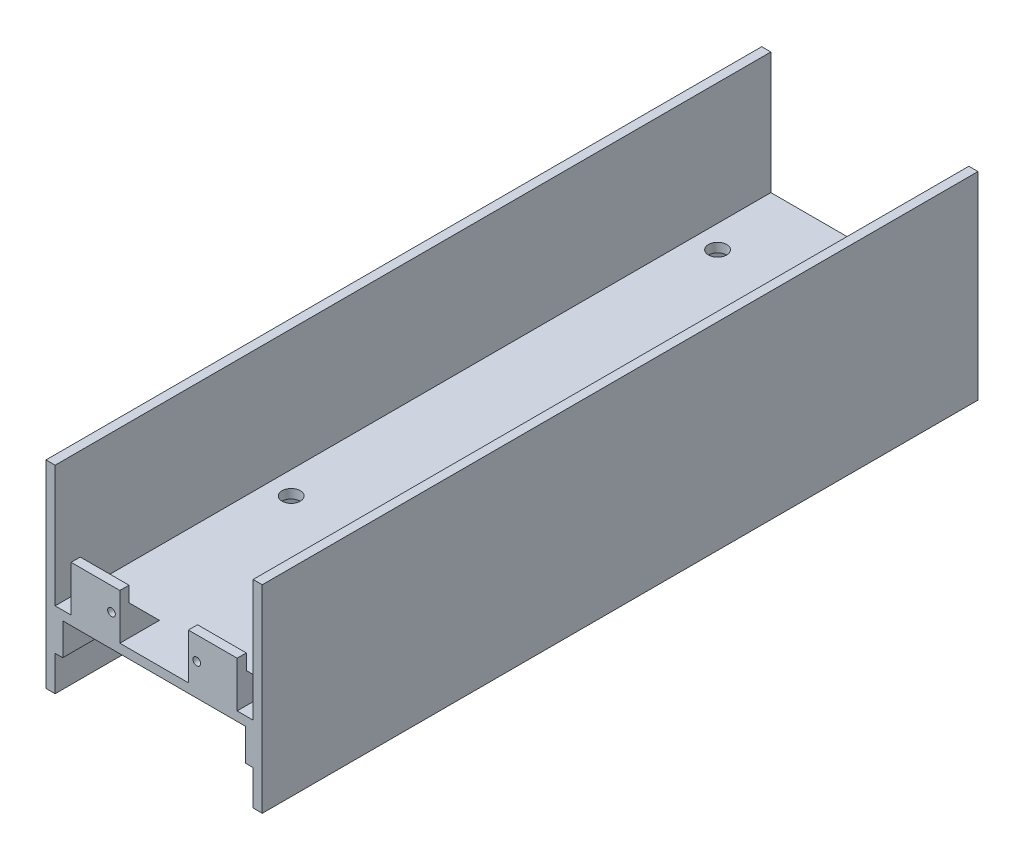
from build123d import *

# Parameters (mm, degrees)
BOSS_EXTRUDE1_DEPTH      = 82
BOSS_EXTRUDE1_DEPTH_BACK = 153
SKETCH3_W                = 16
SKETCH3_H                = 3
BOSS_EXTRUDE3_DEPTH      = 15
CHAMFER1_SIZE            = 10
SKETCH4_R                = 1.25
CUT_EXTRUDE1_DEPTH       = 10
SKETCH2_R                = 3
CUT_EXTRUDE2_DEPTH       = 10


with BuildPart() as part:
    # Sketch1 → Boss-Extrude1 (new, two sides: drawn at the far end of the back side and taken through both)
    with BuildSketch(Plane.XY.offset(-BOSS_EXTRUDE1_DEPTH_BACK)):
        Polygon((-32.5, 13), (-32.5, 1.5), (-35.5, 1.5), (-35.5, 26.5), (-35.5, 66.5), (-32.5, 66.5), (-32.5, 26.5), (32.5, 26.5), (32.5, 66.5), (35.5, 66.5), (35.5, 26.5), (35.5, 1.5), (32.5, 1.5), (32.5, 13), (30, 13), (30, 23.5), (-30, 23.5), (-30, 13), align=None)
    extrude(amount=BOSS_EXTRUDE1_DEPTH + BOSS_EXTRUDE1_DEPTH_BACK)

    # Sketch3 → Boss-Extrude3 (add)
    with BuildSketch(Plane(origin=(0, 26.5, 0), x_dir=(1, 0, 0), z_dir=(0, 1, 0))):
        with Locations((-19.25, -80.5)):
            Rectangle(SKETCH3_W, SKETCH3_H)
        with Locations((19.25, -80.5)):
            Rectangle(SKETCH3_W, SKETCH3_H)
    extrude(amount=BOSS_EXTRUDE3_DEPTH)

    # Chamfer1
    chamfer1_edges = [part.edges().sort_by_distance(p)[0] for p in [
        (-19.25, 26.5, 79),
        (19.25, 26.5, 79),
    ]]
    chamfer(chamfer1_edges, length=CHAMFER1_SIZE)

    # Sketch4 → Cut-Extrude1 (cut)
    with BuildSketch(Plane.XY.offset(82)):
        with Locations((-14, 33.95)):
            Circle(SKETCH4_R)
        with Locations((14, 33.95)):
            Circle(SKETCH4_R)
    extrude(amount=-CUT_EXTRUDE1_DEPTH, mode=Mode.SUBTRACT)

    # Sketch2 → Cut-Extrude2 (cut)
    with BuildSketch(Plane(origin=(0, 26.5, 0), x_dir=(1, 0, 0), z_dir=(0, 1, 0))):
        with Locations(Location((-25, 128, 0), (0, 0, 270))):
            Circle(SKETCH2_R)
        with Locations(Location((25, 128, 0), (0, 0, 270))):
            Circle(SKETCH2_R)
        with Locations(Location((25, -12, 0), (0, 0, 270))):
            Circle(SKETCH2_R)
        with Locations(Location((-25, -12, 0), (0, 0, 270))):
            Circle(SKETCH2_R)
    extrude(amount=-CUT_EXTRUDE2_DEPTH, mode=Mode.SUBTRACT)


solid = part.part
